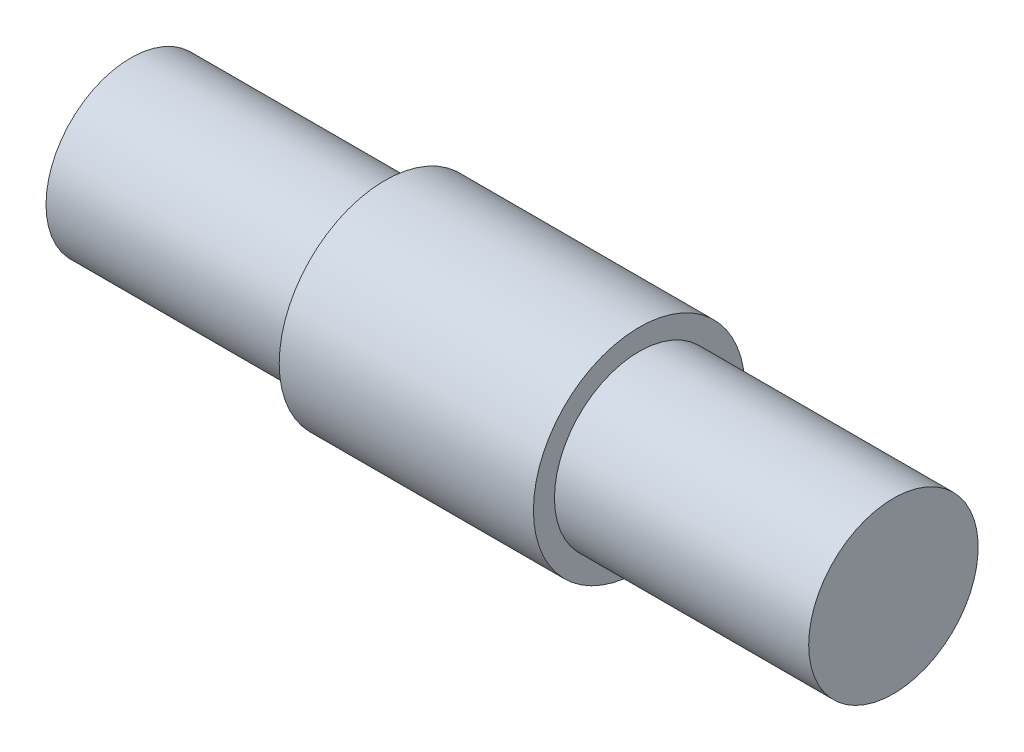
from build123d import *


with BuildPart() as part:
    # Sketch1 → Revolve1 (revolve)
    with BuildSketch(Plane.XY, mode=Mode.PRIVATE) as revolve1_sk:
        Polygon((0, 0), (28.575, 0), (28.575, 3.175), (19.05, 3.175), (19.05, 3.9624), (9.525, 3.9624), (9.525, 3.175), (0, 3.175), align=None)
    revolve(revolve1_sk.sketch.rotate(Axis((0, 0, 0), (1, 0, 0)), 90), axis=Axis((0, 0, 0), (1, 0, 0)))


solid = part.part
